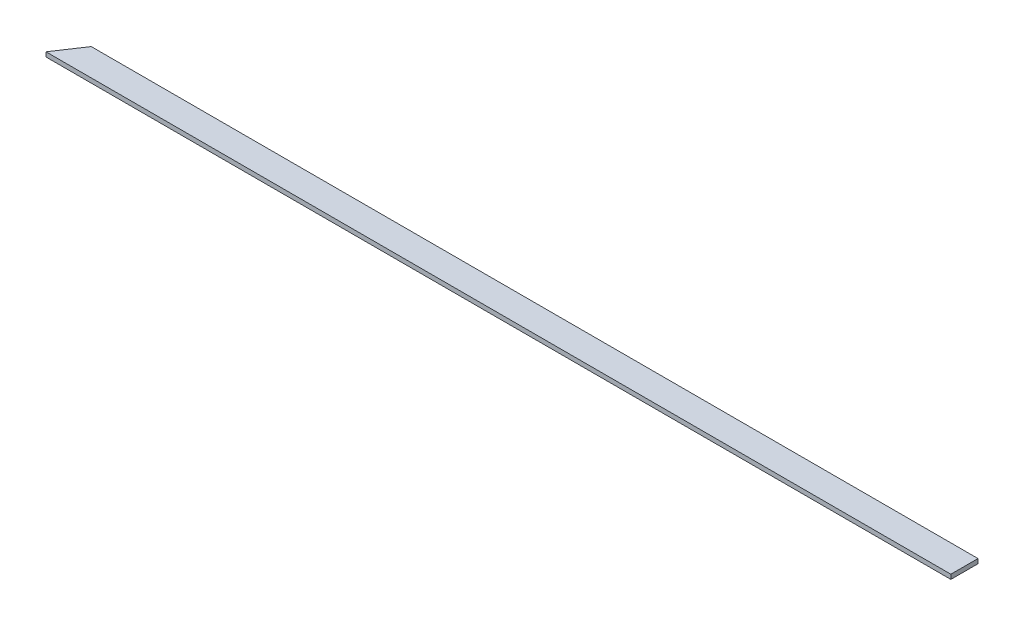
from build123d import *

# Parameters (mm, degrees)
BOSS_EXTRUDE1_DEPTH = 0.125


with BuildPart() as part:
    # Sketch1 → Boss-Extrude1 (new, symmetric)
    with BuildSketch(Plane(origin=(0, 0, 0), x_dir=(1, 0, 0), z_dir=(0, 1, 0))):
        Polygon((-25, 0), (25, 0), (25, 1.5), (-24, 1.5), align=None)
    extrude(amount=BOSS_EXTRUDE1_DEPTH, both=True)


solid = part.part
